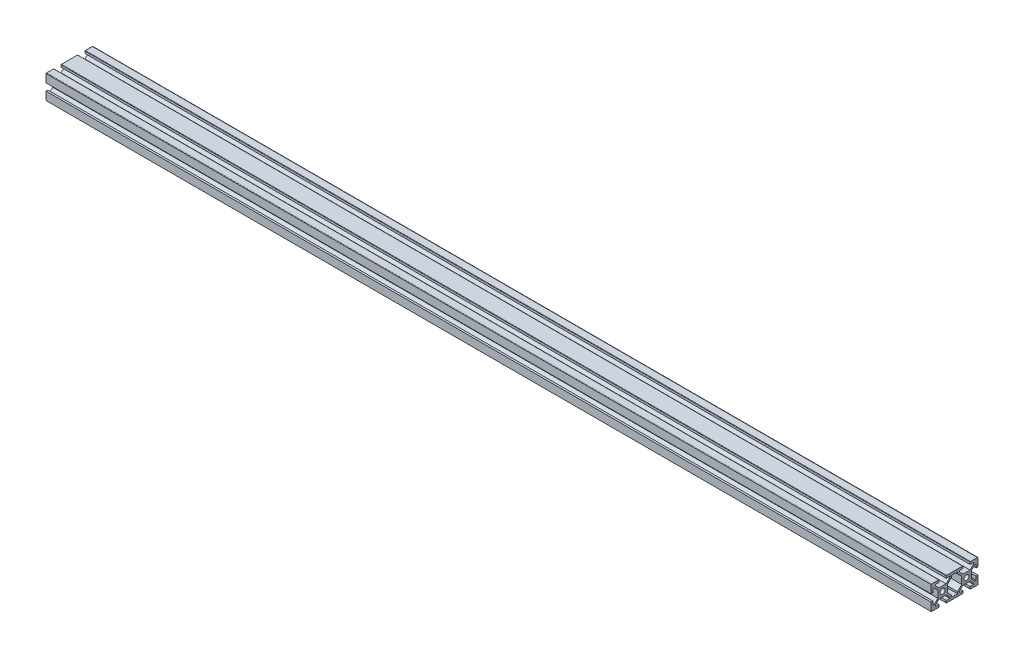
from build123d import *

# Parameters (mm, degrees)
SKETCH_11_R             = 2.1
F_20XS5_20X40S5_1_DEPTH = 740


with BuildPart() as part:
    # 草图11 → 20xs5 20X40S5(1) (new body)
    with BuildSketch(Plane.YZ):
        with BuildLine():
            Line((-10, 19), (-10, 13.3))
            ThreePointArc((-10, 13.3), (-9.912132034, 13.087867966), (-9.7, 13))
            Line((-9.7, 13), (-8, 13))
            Line((-8, 13), (-8, 16))
            Line((-8, 16), (-7.060660172, 16))
            Line((-7.060660172, 16), (-4, 12.939339828))
            Line((-4, 12.939339828), (-4, 7.060660172))
            Line((-4, 7.060660172), (-7.060660172, 4))
            Line((-7.060660172, 4), (-8, 4))
            Line((-8, 4), (-8, 7))
            Line((-8, 7), (-9.7, 7))
            ThreePointArc((-9.7, 7), (-9.912132034, 6.912132034), (-10, 6.7))
            Line((-10, 6.7), (-10, -6.7))
            ThreePointArc((-10, -6.7), (-9.912132034, -6.912132034), (-9.7, -7))
            Line((-9.7, -7), (-8, -7))
            Line((-8, -7), (-8, -4))
            Line((-8, -4), (-7.060660172, -4))
            Line((-7.060660172, -4), (-4, -7.060660172))
            Line((-4, -7.060660172), (-4, -12.939339828))
            Line((-4, -12.939339828), (-7.060660172, -16))
            Line((-7.060660172, -16), (-8, -16))
            Line((-8, -16), (-8, -13))
            Line((-8, -13), (-9.7, -13))
            ThreePointArc((-9.7, -13), (-9.912132034, -13.087867966), (-10, -13.3))
            Line((-10, -13.3), (-10, -19))
            ThreePointArc((-10, -19), (-9.948683298, -19.316227766), (-9.8, -19.6))
            Line((-9.8, -19.6), (-3, -19.6))
            Line((-3, -19.6), (-3, -18))
            Line((-3, -18), (-6, -18))
            Line((-6, -18), (-6, -17.060660172))
            Line((-6, -17.060660172), (-2.939339828, -14))
            Line((-2.939339828, -14), (2.939339828, -14))
            Line((2.939339828, -14), (6, -17.060660172))
            Line((6, -17.060660172), (6, -18))
            Line((6, -18), (3, -18))
            Line((3, -18), (3, -19.6))
            Line((3, -19.6), (9.8, -19.6))
            ThreePointArc((9.8, -19.6), (9.948683298, -19.316227766), (10, -19))
            Line((10, -19), (10, -13.3))
            ThreePointArc((10, -13.3), (9.912132034, -13.087867966), (9.7, -13))
            Line((9.7, -13), (8, -13))
            Line((8, -13), (8, -16))
            Line((8, -16), (7.060660172, -16))
            Line((7.060660172, -16), (4, -12.939339828))
            Line((4, -12.939339828), (4, -7.060660172))
            Line((4, -7.060660172), (7.060660172, -4))
            Line((7.060660172, -4), (8, -4))
            Line((8, -4), (8, -7))
            Line((8, -7), (9.7, -7))
            ThreePointArc((9.7, -7), (9.912132034, -6.912132034), (10, -6.7))
            Line((10, -6.7), (10, 6.7))
            ThreePointArc((10, 6.7), (9.912132034, 6.912132034), (9.7, 7))
            Line((9.7, 7), (8, 7))
            Line((8, 7), (8, 4))
            Line((8, 4), (7.060660172, 4))
            Line((7.060660172, 4), (4, 7.060660172))
            Line((4, 7.060660172), (4, 12.939339828))
            Line((4, 12.939339828), (7.060660172, 16))
            Line((7.060660172, 16), (8, 16))
            Line((8, 16), (8, 13))
            Line((8, 13), (9.7, 13))
            ThreePointArc((9.7, 13), (9.912132034, 13.087867966), (10, 13.3))
            Line((10, 13.3), (10, 19))
            ThreePointArc((10, 19), (9.948683298, 19.316227766), (9.8, 19.6))
            Line((9.8, 19.6), (3, 19.6))
            Line((3, 19.6), (3, 18))
            Line((3, 18), (6, 18))
            Line((6, 18), (6, 17.060660172))
            Line((6, 17.060660172), (2.939339828, 14))
            Line((2.939339828, 14), (-2.939339828, 14))
            Line((-2.939339828, 14), (-6, 17.060660172))
            Line((-6, 17.060660172), (-6, 18))
            Line((-6, 18), (-3, 18))
            Line((-3, 18), (-3, 19.6))
            Line((-3, 19.6), (-9.8, 19.6))
            ThreePointArc((-9.8, 19.6), (-9.948683298, 19.316227766), (-10, 19))
        make_face()
        with Locations((0, -10)):
            Circle(SKETCH_11_R, mode=Mode.SUBTRACT)
        with Locations((0, 10)):
            Circle(SKETCH_11_R, mode=Mode.SUBTRACT)
        Polygon((-8, -2.5), (-6.439339828, -2.5), (-2.939339828, -6), (2.939339828, -6), (6.439339828, -2.5), (8, -2.5), (8, 2.5), (6.439339828, 2.5), (2.939339828, 6), (-2.939339828, 6), (-6.439339828, 2.5), (-8, 2.5), align=None, mode=Mode.SUBTRACT)
    extrude(amount=F_20XS5_20X40S5_1_DEPTH)


solid = part.part
